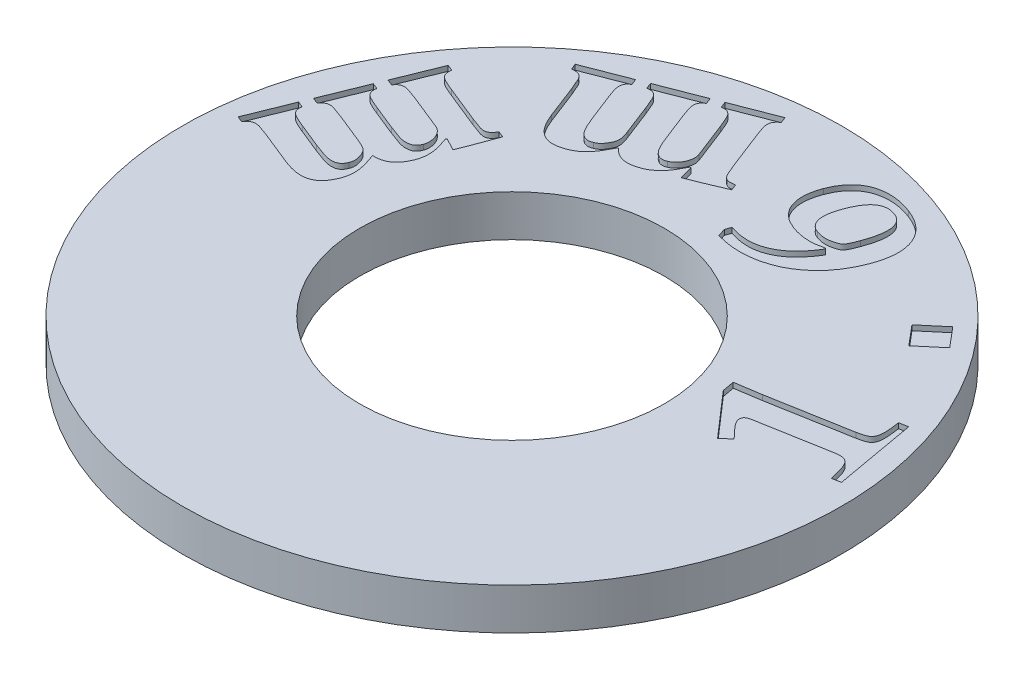
from build123d import *

# Parameters (mm, degrees)
SKETCH1_R           = 12.7
BOSS_EXTRUDE1_DEPTH = 1.6
SKETCH2_R           = 5.8674
CUT_EXTRUDE1_DEPTH  = 19.031638861
CUT_EXTRUDE2_DEPTH  = 0.2


with BuildPart() as part:
    # Sketch1 → Boss-Extrude1 (new body)
    with BuildSketch(Plane(origin=(0, 0, 0), x_dir=(1, 0, 0), z_dir=(0, 1, 0))):
        with Locations(Location((0, 0, 0), (0, 0, 270))):
            Circle(SKETCH1_R)
    extrude(amount=BOSS_EXTRUDE1_DEPTH)

    # Sketch2 → Cut-Extrude1 (cut, through all)
    with BuildSketch(Plane(origin=(0, 0, 0), x_dir=(-1, 0, 0), z_dir=(0, -1, 0))):
        with Locations(Location((0, 0, 0), (0, 0, 90))):
            Circle(SKETCH2_R)
    extrude(amount=-CUT_EXTRUDE1_DEPTH, mode=Mode.SUBTRACT)

    # Sketch4 → Cut-Extrude2 (cut)
    # profile 1 of 5: a face of its own
    with BuildSketch(Plane(origin=(0, 1.6, 0), x_dir=(1, 0, 0), z_dir=(0, 1, 0))):
        with BuildLine():
            add(Edge.make_bspline(
                [(10.502835701, 2.747256944), (10.535958787, 2.753635056), (10.597619367, 2.765508288), (10.68289299, 2.785497337), (10.754934333, 2.804751749), (10.83115688, 2.831434792), (10.908616374, 2.872710013), (10.983063242, 2.939891348), (11.031547566, 3.030268528), (11.057288986, 3.142661226), (11.066935793, 3.278500029), (11.06128653, 3.408848056), (11.053268397, 3.529765111), (11.041774037, 3.63744486), (11.026137193, 3.758286119), (11.014089218, 3.843452977), (11.007748896, 3.888272569)],
                knots=[0, 0, 0, 0, 0.95120931, 1.770732274, 2.469728581, 3.053236218, 4.045778316, 4.92566005, 5.839669914, 6.887844203, 8.156461987, 9.670137205, 10.563586198, 11.574197932, 12.723406461, 14, 14, 14, 14], degree=3))
            Line((11.007748896, 3.888272569), (11.339580493, 3.947803819))
            Line((11.339580493, 3.947803819), (11.900717646, 0.795954861))
            Line((11.900717646, 0.795954861), (11.568886048, 0.736423611))
            add(Edge.make_bspline(
                [(11.568886048, 0.736423611), (11.554803043, 0.798585514), (11.528746521, 0.913598105), (11.489384912, 1.071011026), (11.453602851, 1.199155265), (11.419912183, 1.300799564), (11.386730997, 1.382540059), (11.35336047, 1.450924625), (11.316835265, 1.508004968), (11.277656715, 1.55458428), (11.234590877, 1.59165404), (11.187644786, 1.62258404), (11.134361285, 1.64406377), (11.074344364, 1.659243306), (11.003086635, 1.66500658), (10.917056963, 1.663740947), (10.814442972, 1.651454292), (10.740904843, 1.639267459), (10.701273201, 1.632699653)],
                knots=[0, 0, 0, 0, 2.063073641, 3.817120061, 5.251678484, 6.368851115, 7.281122152, 8.10565521, 8.828216282, 9.469439415, 10.068097664, 10.662010233, 11.280545861, 11.918117793, 12.659047895, 13.586927584, 14.699531502, 16, 16, 16, 16], degree=3))
            Line((10.701273201, 1.632699653), (8.060952021, 1.163064236))
            add(Edge.make_bspline(
                [(8.060952021, 1.163064236), (8.037667348, 1.158078091), (7.994477264, 1.148829432), (7.936130638, 1.128346498), (7.889333412, 1.101785371), (7.854520705, 1.069466258), (7.829800128, 1.032851206), (7.817133941, 0.991590699), (7.810708439, 0.947006345), (7.815062759, 0.916476287), (7.817314868, 0.900685764)],
                knots=[0, 0, 0, 0, 1.400993529, 2.598663486, 3.626413984, 4.544745121, 5.372764933, 6.19368933, 7.065753812, 8, 8, 8, 8], degree=3))
            add(Edge.make_bspline(
                [(7.817314868, 0.900685764), (7.821529308, 0.883943745), (7.830815176, 0.847055295), (7.859831933, 0.790796719), (7.896481283, 0.725393275), (7.938756081, 0.667449744), (7.979789109, 0.614975147), (8.018534287, 0.568769553), (8.063746687, 0.516951587), (8.115980512, 0.459628299), (8.174041538, 0.395714584), (8.239200773, 0.326359636), (8.310840637, 0.251371205), (8.361130158, 0.199858655), (8.387271465, 0.173081597)],
                knots=[0, 0, 0, 0, 0.664509197, 1.464143271, 2.430196891, 3.559892813, 4.226820614, 5.002434619, 5.887259823, 6.881648262, 7.996278507, 9.220784234, 10.555318662, 12, 12, 12, 12], degree=3))
            Line((8.387271465, 0.173081597), (8.04000584, -0.117960069))
            Line((8.04000584, -0.117960069), (6.557236743, 1.585295139))
            Line((6.557236743, 1.585295139), (6.473452021, 2.052725694))
            add(Edge.make_bspline(
                [(6.473452021, 2.052725694), (6.504325495, 2.056351962), (6.569060101, 2.063955416), (6.670587219, 2.076897917), (6.780259537, 2.094127133), (6.898350755, 2.111263083), (7.024355019, 2.131394976), (7.158854817, 2.153428708), (7.301825046, 2.177571224), (7.399872247, 2.194875437), (7.450205493, 2.203758681)],
                knots=[0, 0, 0, 0, 0.754743075, 1.582523401, 2.484708457, 3.449980394, 4.479693127, 5.582710837, 6.759066988, 8, 8, 8, 8], degree=3))
            Line((7.450205493, 2.203758681), (10.502835701, 2.747256944))
        make_face()
    # profile 2 of 5: a face of its own
    with BuildSketch(Plane(origin=(0, 1.6, 0), x_dir=(1, 0, 0), z_dir=(0, 1, 0))):
        Polygon((7.998334498, 7.413598887), (8.851615748, 8.134588471), (9.493230331, 7.375013818), (8.639949081, 6.654024235), align=None)
    # profile 3 of 5: a face of its own
    with BuildSketch(Plane(origin=(0, 1.6, 0), x_dir=(1, 0, 0), z_dir=(0, 1, 0))):
        with BuildLine():
            Line((1.200452366, 6.983777969), (1.280929797, 7.199854358))
            add(Edge.make_bspline(
                [(1.280929797, 7.199854358), (1.343817795, 7.179261353), (1.467155686, 7.138873713), (1.654011169, 7.098413309), (1.836977253, 7.07493453), (2.015597423, 7.068035969), (2.190562747, 7.078072145), (2.361694864, 7.104178741), (2.529159758, 7.148459834), (2.691452106, 7.211129672), (2.849876645, 7.288087424), (3.00262888, 7.382899312), (3.150358517, 7.492976917), (3.291751018, 7.620066885), (3.42880272, 7.760899591), (3.558935253, 7.919039208), (3.685331048, 8.091932582), (3.761884595, 8.216465585), (3.801086047, 8.280236302)],
                knots=[0, 0, 0, 0, 1.055048788, 2.0691944, 3.044229261, 3.994526873, 4.916374231, 5.835814113, 6.751508959, 7.673635849, 8.606948974, 9.557047682, 10.537179467, 11.541963796, 12.586653235, 13.668953384, 14.806320344, 16, 16, 16, 16], degree=3))
            Line((3.801086047, 8.280236302), (3.770217991, 8.307797066))
            add(Edge.make_bspline(
                [(3.770217991, 8.307797066), (3.71414798, 8.294562398), (3.604496336, 8.268680414), (3.440218512, 8.243045281), (3.280238818, 8.230703616), (3.12312468, 8.231653016), (2.966792107, 8.24638583), (2.809094217, 8.274242223), (2.648638057, 8.314787763), (2.542955388, 8.351804744), (2.489193686, 8.370635608)],
                knots=[0, 0, 0, 0, 1.05963004, 2.072233846, 3.055361679, 4.0086536, 4.959232627, 5.940685308, 6.95240852, 8, 8, 8, 8], degree=3))
            add(Edge.make_bspline(
                [(2.489193686, 8.370635608), (2.425678851, 8.396737335), (2.302249784, 8.447461105), (2.132920474, 8.545831273), (1.986886121, 8.662813599), (1.863257967, 8.795473288), (1.764751057, 8.943805026), (1.688468588, 9.103519705), (1.639308535, 9.275732636), (1.612688242, 9.457753868), (1.611225732, 9.648604645), (1.633351871, 9.846131474), (1.675600618, 10.050562667), (1.722178032, 10.185318726), (1.746155491, 10.254689427)],
                knots=[0, 0, 0, 0, 1.077595584, 2.094103196, 3.062986482, 4.006354381, 4.929902502, 5.848931818, 6.774838988, 7.731371815, 8.729829957, 9.762912156, 10.848375697, 12, 12, 12, 12], degree=3))
            add(Edge.make_bspline(
                [(1.746155491, 10.254689427), (1.7763527, 10.329017713), (1.835212514, 10.473896968), (1.951299256, 10.672660048), (2.085665588, 10.848945539), (2.213804547, 10.97741434), (2.326332688, 11.065860187), (2.414590439, 11.126148678), (2.508811454, 11.177493313), (2.606907441, 11.223070875), (2.710126865, 11.260830416), (2.818355474, 11.290046763), (2.930920772, 11.313549546), (3.048111242, 11.328816613), (3.169265694, 11.336319095), (3.294130713, 11.336644782), (3.422555278, 11.327106532), (3.55443731, 11.311041992), (3.689828281, 11.285147679), (3.828062677, 11.250881114), (3.970010998, 11.208775039), (4.064699677, 11.175620405), (4.113073894, 11.158682483)],
                knots=[0, 0, 0, 0, 1.672877526, 3.260740491, 4.787171376, 6.289516588, 7.032212332, 7.772527889, 8.517517252, 9.269110702, 10.028607479, 10.808285605, 11.607046719, 12.427139982, 13.272559756, 14.139283271, 15.03113053, 15.958707747, 16.910946222, 17.906201506, 18.93032764, 20, 20, 20, 20], degree=3))
            add(Edge.make_bspline(
                [(4.113073894, 11.158682483), (4.15697111, 11.141450954), (4.243422618, 11.107515052), (4.368170705, 11.050419534), (4.484996173, 10.987386071), (4.59493391, 10.920003123), (4.697245283, 10.847353308), (4.79277647, 10.769806838), (4.880831456, 10.687287685), (4.961582993, 10.600024174), (5.034609675, 10.508303615), (5.099779246, 10.41208411), (5.157520331, 10.31176066), (5.205939239, 10.20638206), (5.246771826, 10.09693552), (5.280219809, 9.983207721), (5.303980564, 9.864730901), (5.320880501, 9.742517717), (5.328043678, 9.616488704), (5.328305305, 9.48689334), (5.319416583, 9.353933132), (5.301199014, 9.21787529), (5.276088854, 9.078654194), (5.241524935, 8.936320611), (5.198718022, 8.790527437), (5.163826853, 8.693479882), (5.146051325, 8.644038385)],
                knots=[0, 0, 0, 0, 1.098191461, 2.162786548, 3.192832132, 4.188048845, 5.164054587, 6.113082797, 7.051594597, 7.972179555, 8.879742853, 9.779402692, 10.67641257, 11.572442019, 12.476973698, 13.395128669, 14.330043427, 15.288670823, 16.266176383, 17.267519822, 18.30535816, 19.36692158, 20.463110258, 21.598586896, 22.776584751, 24, 24, 24, 24], degree=3))
            add(Edge.make_bspline(
                [(5.146051325, 8.644038385), (5.120410458, 8.577547881), (5.069504659, 8.445541726), (4.979642143, 8.255748764), (4.882591907, 8.073477), (4.7757546, 7.901071263), (4.66050112, 7.736651354), (4.536347737, 7.581334242), (4.401952184, 7.435476143), (4.260695193, 7.298015339), (4.111468893, 7.171081941), (3.956153925, 7.054726669), (3.793202875, 6.951568523), (3.625965791, 6.857262903), (3.452169721, 6.775166977), (3.271848517, 6.706482366), (3.086418619, 6.645984938), (2.895066533, 6.599208672), (2.700286371, 6.564048118), (2.50372428, 6.540540621), (2.305560774, 6.530620344), (2.106360141, 6.534210416), (1.905755587, 6.549850704), (1.704278713, 6.57711169), (1.501495309, 6.618153508), (1.367468793, 6.65450437), (1.299671116, 6.672892552)],
                knots=[0, 0, 0, 0, 1.070823632, 2.125947334, 3.153976389, 4.173332704, 5.172465224, 6.170528418, 7.159609897, 8.15178657, 9.131336938, 10.102378564, 11.066150857, 12.028085339, 12.986779263, 13.952022445, 14.926733186, 15.916739616, 16.91025301, 17.90025944, 18.890219644, 19.890115268, 20.892859756, 21.913053768, 22.944312598, 24, 24, 24, 24], degree=3))
            Line((1.299671116, 6.672892552), (1.200452366, 6.983777969))
        make_face()
        with BuildLine():
            add(Edge.make_bspline(
                [(3.076789172, 8.698057483), (3.132909456, 8.679932439), (3.243010075, 8.644373488), (3.413032857, 8.625283629), (3.576075832, 8.63331494), (3.704133547, 8.658205157), (3.795432605, 8.686357261), (3.852529709, 8.707316756), (3.898519111, 8.728016151), (3.948692476, 8.75488002), (4.001805532, 8.805818747), (4.047266948, 8.872729684), (4.084461884, 8.946478634), (4.119923668, 9.023856133), (4.158569665, 9.121872517), (4.186258552, 9.19376456), (4.201268339, 9.232736302)],
                knots=[0, 0, 0, 0, 1.710541778, 3.355858038, 4.938271646, 6.440062148, 7.13262002, 7.713873542, 8.206199276, 8.598318393, 9.361997601, 10.313061428, 10.938824559, 11.760841173, 12.786181087, 14, 14, 14, 14], degree=3))
            add(Edge.make_bspline(
                [(4.201268339, 9.232736302), (4.219616657, 9.284432015), (4.255072374, 9.384327197), (4.30105685, 9.531510269), (4.335960436, 9.671161482), (4.362974871, 9.803145166), (4.381080853, 9.927152769), (4.388903885, 10.043638718), (4.388039482, 10.152006568), (4.378848483, 10.252989558), (4.358648581, 10.346021304), (4.330820471, 10.43180026), (4.290949714, 10.508625418), (4.24422561, 10.579514316), (4.184064175, 10.639885789), (4.116891173, 10.694879513), (4.038769365, 10.7401109), (3.982187335, 10.763211055), (3.953221464, 10.775036649)],
                knots=[0, 0, 0, 0, 1.500894568, 2.900281813, 4.217152542, 5.437764563, 6.585289063, 7.643385764, 8.628806701, 9.548256839, 10.412033135, 11.229197673, 12.007129352, 12.774066827, 13.542058149, 14.328777375, 15.144455933, 16, 16, 16, 16], degree=3))
            add(Edge.make_bspline(
                [(3.953221464, 10.775036649), (3.919245977, 10.786364872), (3.853943728, 10.80813817), (3.75608292, 10.828911875), (3.662442482, 10.834694319), (3.573482634, 10.826592591), (3.488865702, 10.807977138), (3.408458099, 10.777657234), (3.332269753, 10.736631897), (3.260047544, 10.685155263), (3.191439608, 10.624053207), (3.126309215, 10.552989981), (3.064446481, 10.472120724), (2.985796284, 10.348662157), (2.892809985, 10.174619164), (2.834135004, 10.024617309), (2.803386394, 9.946008871)],
                knots=[0, 0, 0, 0, 0.932873925, 1.793021151, 2.598839487, 3.367856657, 4.113627244, 4.849993345, 5.599749579, 6.36230028, 7.155964143, 7.989527263, 8.87058289, 9.805567893, 11.801908814, 14, 14, 14, 14], degree=3))
            add(Edge.make_bspline(
                [(2.803386394, 9.946008871), (2.789021343, 9.905717802), (2.761142699, 9.82752383), (2.727163126, 9.711565588), (2.69985937, 9.601384176), (2.682829992, 9.496212874), (2.670852833, 9.39695612), (2.668292805, 9.303160591), (2.675472645, 9.215066626), (2.688060026, 9.132630092), (2.708521729, 9.055609287), (2.739278462, 8.985918652), (2.775041981, 8.920834938), (2.820963864, 8.863655968), (2.873499986, 8.812178352), (2.933526127, 8.766434912), (3.002012742, 8.728007435), (3.051553194, 8.708165164), (3.076789172, 8.698057483)],
                knots=[0, 0, 0, 0, 1.424088551, 2.763767271, 4.022183305, 5.201039714, 6.30911801, 7.349523498, 8.319005133, 9.248428938, 10.124185317, 10.962911168, 11.779474492, 12.589779123, 13.394520957, 14.224182145, 15.095395788, 16, 16, 16, 16], degree=3))
        make_face(mode=Mode.SUBTRACT)
    # profile 4 of 5: a face of its own
    with BuildSketch(Plane(origin=(0, 1.6, 0), x_dir=(1, 0, 0), z_dir=(0, 1, 0))):
        with BuildLine():
            Line((-1.500499582, 8.398806621), (-1.545699235, 8.394396899))
            add(Edge.make_bspline(
                [(-1.545699235, 8.394396899), (-1.578680129, 8.328177935), (-1.64156419, 8.201919461), (-1.744030648, 8.02884167), (-1.846044886, 7.880084841), (-1.949946333, 7.754727011), (-2.05857315, 7.650318657), (-2.17357881, 7.562688436), (-2.294646542, 7.48709386), (-2.38188138, 7.450331118), (-2.425438818, 7.431975024)],
                knots=[0, 0, 0, 0, 1.327248858, 2.530640849, 3.606312378, 4.561298934, 5.447501221, 6.30354898, 7.15294094, 8, 8, 8, 8], degree=3))
            add(Edge.make_bspline(
                [(-2.425438818, 7.431975024), (-2.466711164, 7.416501822), (-2.546064862, 7.386751738), (-2.664025189, 7.356362389), (-2.774202536, 7.336715383), (-2.877415506, 7.329477021), (-2.975012839, 7.335492968), (-3.068194376, 7.350780271), (-3.158059284, 7.376341345), (-3.244768044, 7.411813357), (-3.328951411, 7.458526601), (-3.408552551, 7.519497131), (-3.489562903, 7.588502591), (-3.538054885, 7.643001758), (-3.563147151, 7.671202454)],
                knots=[0, 0, 0, 0, 1.261849166, 2.426137807, 3.483538902, 4.464561663, 5.381899843, 6.278343648, 7.164718223, 8.052217243, 8.957088943, 9.91293841, 10.920046081, 12, 12, 12, 12], degree=3))
            add(Edge.make_bspline(
                [(-3.563147151, 7.671202454), (-3.599531182, 7.59843004), (-3.668389116, 7.460705936), (-3.777147706, 7.27123298), (-3.885029972, 7.111206789), (-3.99057811, 6.976050247), (-4.102053829, 6.86480688), (-4.219976724, 6.770641123), (-4.348199055, 6.69203994), (-4.439779694, 6.652578048), (-4.485881526, 6.632712871)],
                knots=[0, 0, 0, 0, 1.370148351, 2.593049264, 3.676206861, 4.618613109, 5.476374145, 6.322127868, 7.155356622, 8, 8, 8, 8], degree=3))
            add(Edge.make_bspline(
                [(-4.485881526, 6.632712871), (-4.530445251, 6.616076964), (-4.615952839, 6.584156465), (-4.743101562, 6.551526654), (-4.861772979, 6.530294812), (-4.973189572, 6.524827778), (-5.078684173, 6.531644554), (-5.178538203, 6.555233414), (-5.275449977, 6.587065021), (-5.366578661, 6.635862424), (-5.452894115, 6.696968271), (-5.534744327, 6.770753064), (-5.613569564, 6.855921676), (-5.687290851, 6.95508305), (-5.757960734, 7.067347228), (-5.826043906, 7.19293182), (-5.891036555, 7.332819596), (-5.93122393, 7.431428083), (-5.952114165, 7.482686829)],
                knots=[0, 0, 0, 0, 1.164238848, 2.233907847, 3.210467445, 4.111618036, 4.95998529, 5.789768502, 6.618037198, 7.451375979, 8.310370773, 9.20280479, 10.145472204, 11.148103074, 12.224265042, 13.392220349, 14.64442181, 16, 16, 16, 16], degree=3))
            Line((-5.952114165, 7.482686829), (-6.443798193, 8.752686829))
            add(Edge.make_bspline(
                [(-6.443798193, 8.752686829), (-6.46298886, 8.80204742), (-6.500138469, 8.897600464), (-6.557518406, 9.031550001), (-6.610596713, 9.14701544), (-6.6652213, 9.236719574), (-6.719195792, 9.30301382), (-6.776882541, 9.349899558), (-6.841998121, 9.381410269), (-6.91741995, 9.396764093), (-7.003583166, 9.400735532), (-7.06413052, 9.395102303), (-7.096437082, 9.392096552)],
                knots=[0, 0, 0, 0, 1.559140996, 3.018210822, 4.290952874, 5.296787436, 6.103062558, 6.795868098, 7.468525882, 8.211398264, 9.045646607, 10, 10, 10, 10], degree=3))
            Line((-7.096437082, 9.392096552), (-7.185733957, 9.621402107))
            Line((-7.185733957, 9.621402107), (-5.508937082, 10.271836135))
            Line((-5.508937082, 10.271836135), (-5.419640207, 10.042530579))
            add(Edge.make_bspline(
                [(-5.419640207, 10.042530579), (-5.44126826, 10.026399982), (-5.481650493, 9.996282175), (-5.533846741, 9.947929725), (-5.570951767, 9.898212078), (-5.594627254, 9.847372575), (-5.604920024, 9.794555745), (-5.609329846, 9.738344691), (-5.607052869, 9.676900081), (-5.596124222, 9.607106489), (-5.574701737, 9.523170129), (-5.540686924, 9.418742082), (-5.495430219, 9.289738424), (-5.459929128, 9.196145913), (-5.440586387, 9.145152107)],
                knots=[0, 0, 0, 0, 0.976263073, 1.822803084, 2.564919562, 3.207680077, 3.833713685, 4.500778585, 5.245986733, 6.052842077, 7.052732165, 8.377616694, 10.026347317, 12, 12, 12, 12], degree=3))
            Line((-5.440586387, 9.145152107), (-5.077886735, 8.212495857))
            add(Edge.make_bspline(
                [(-5.077886735, 8.212495857), (-5.058213378, 8.162818328), (-5.020773209, 8.068277516), (-4.964958774, 7.935032266), (-4.911566849, 7.817607376), (-4.862407323, 7.714442109), (-4.814206633, 7.625009471), (-4.764214553, 7.549826783), (-4.714948421, 7.485912263), (-4.663879121, 7.434812521), (-4.612373766, 7.394089192), (-4.560879865, 7.363706829), (-4.510177119, 7.340304693), (-4.45834347, 7.326789669), (-4.404290481, 7.322415505), (-4.347102358, 7.327322637), (-4.286499427, 7.340839251), (-4.245784961, 7.355102318), (-4.224605485, 7.362521899)],
                knots=[0, 0, 0, 0, 1.886072366, 3.589365554, 5.098767554, 6.438935382, 7.62327005, 8.680997452, 9.623029443, 10.466885591, 11.224590498, 11.934248244, 12.573028465, 13.189694188, 13.814492117, 14.478078476, 15.208303495, 16, 16, 16, 16], degree=3))
            add(Edge.make_bspline(
                [(-4.224605485, 7.362521899), (-4.196124879, 7.375107043), (-4.140617846, 7.399634753), (-4.06647594, 7.453951996), (-4.002096369, 7.521299194), (-3.946506985, 7.600529328), (-3.897145713, 7.683379182), (-3.857845601, 7.766968153), (-3.829112457, 7.850147785), (-3.819086508, 7.936966256), (-3.820853325, 8.026934807), (-3.836167036, 8.105507556), (-3.855045624, 8.176985637), (-3.877649694, 8.244743013), (-3.906253353, 8.326857924), (-3.92895999, 8.385647919), (-3.941280832, 8.41754794)],
                knots=[0, 0, 0, 0, 1.05712718, 2.060278967, 3.103930472, 4.214663213, 5.347149753, 6.382223774, 7.355140304, 8.326206341, 9.339519046, 10.406659634, 11.040664636, 11.855394827, 12.836316401, 14, 14, 14, 14], degree=3))
            Line((-3.941280832, 8.41754794), (-4.381150624, 9.551948982))
            add(Edge.make_bspline(
                [(-4.381150624, 9.551948982), (-4.395843684, 9.589066049), (-4.42322045, 9.65822422), (-4.461713942, 9.755215287), (-4.496936471, 9.837422587), (-4.535923805, 9.924848545), (-4.581174005, 10.013011645), (-4.639853073, 10.097027896), (-4.70584835, 10.158300648), (-4.770957186, 10.189348355), (-4.82925529, 10.203846904), (-4.881158179, 10.209027832), (-4.940539071, 10.208514609), (-4.982726237, 10.205229651), (-5.005126318, 10.20348544)],
                knots=[0, 0, 0, 0, 1.43593228, 2.675492938, 3.753329024, 4.652559938, 6.11901344, 7.311444819, 8.322447917, 9.321542641, 9.866545793, 10.478167495, 11.191953967, 12, 12, 12, 12], degree=3))
            Line((-5.005126318, 10.20348544), (-5.094423193, 10.432790996))
            Line((-5.094423193, 10.432790996), (-3.438572499, 11.074405579))
            Line((-3.438572499, 11.074405579), (-3.349275624, 10.845100024))
            add(Edge.make_bspline(
                [(-3.349275624, 10.845100024), (-3.371829284, 10.829185098), (-3.413734166, 10.799615038), (-3.465251913, 10.749034653), (-3.503876703, 10.69980329), (-3.528520914, 10.648919497), (-3.540482433, 10.595811986), (-3.544340482, 10.539416273), (-3.542185737, 10.47838512), (-3.531505961, 10.409501208), (-3.508063178, 10.326746257), (-3.474739068, 10.222065038), (-3.429638126, 10.092106636), (-3.393324208, 9.997946719), (-3.373529096, 9.946619121)],
                knots=[0, 0, 0, 0, 0.992957471, 1.844922954, 2.591631667, 3.237113429, 3.86329802, 4.54058269, 5.269232777, 6.059395145, 7.045266299, 8.364235463, 10.018105088, 12, 12, 12, 12], degree=3))
            Line((-3.373529096, 9.946619121), (-3.010829443, 9.013962871))
            add(Edge.make_bspline(
                [(-3.010829443, 9.013962871), (-2.996657788, 8.977151092), (-2.969516159, 8.906648973), (-2.928004225, 8.806398578), (-2.891454916, 8.714556702), (-2.844654724, 8.610739499), (-2.791764113, 8.500780224), (-2.730333993, 8.390242101), (-2.666711658, 8.305624809), (-2.604799685, 8.236574129), (-2.538315851, 8.186697449), (-2.473039115, 8.148601797), (-2.403922676, 8.128561555), (-2.329787806, 8.121444181), (-2.246708712, 8.132336889), (-2.1910254, 8.152150967), (-2.160855485, 8.162886482)],
                knots=[0, 0, 0, 0, 1.218376668, 2.33344156, 3.351562828, 4.271279059, 5.850097088, 7.121466675, 8.168044415, 9.115705124, 9.973893436, 10.725810247, 11.436861629, 12.177817345, 13.012718608, 14, 14, 14, 14], degree=3))
            add(Edge.make_bspline(
                [(-2.160855485, 8.162886482), (-2.139651487, 8.17267279), (-2.096037015, 8.192802233), (-2.034047516, 8.233544001), (-1.97680789, 8.28717359), (-1.920611109, 8.347803533), (-1.870920225, 8.417558281), (-1.828079155, 8.49341736), (-1.795216046, 8.575437602), (-1.771331247, 8.661942034), (-1.756280888, 8.749896331), (-1.755281747, 8.83758026), (-1.766801807, 8.92340652), (-1.78547311, 8.977820506), (-1.79484854, 9.005143427)],
                knots=[0, 0, 0, 0, 0.836243377, 1.720067758, 2.64304706, 3.640427864, 4.67827718, 5.704026804, 6.755486752, 7.835339964, 8.915594534, 9.942780013, 10.967007125, 12, 12, 12, 12], degree=3))
            Line((-1.79484854, 9.005143427), (-2.317400624, 10.352313565))
            add(Edge.make_bspline(
                [(-2.317400624, 10.352313565), (-2.337449883, 10.40272207), (-2.374297839, 10.495366407), (-2.426816724, 10.620893065), (-2.471793057, 10.720796935), (-2.510807835, 10.798084427), (-2.54947846, 10.857414013), (-2.587241421, 10.906814316), (-2.629873376, 10.945553523), (-2.675175925, 10.977219168), (-2.728120542, 10.998709343), (-2.789785301, 11.010093904), (-2.861054931, 11.0134522), (-2.911278956, 11.00790917), (-2.938069026, 11.004952454)],
                knots=[0, 0, 0, 0, 1.95560344, 3.594147164, 4.904245662, 5.905587673, 6.710271926, 7.455046029, 8.139409163, 8.778697916, 9.437986146, 10.180991047, 11.02971977, 12, 12, 12, 12], degree=3))
            Line((-2.938069026, 11.004952454), (-3.027365901, 11.23425801))
            Line((-3.027365901, 11.23425801), (-1.360490901, 11.880282315))
            Line((-1.360490901, 11.880282315), (-1.271194026, 11.65097676))
            add(Edge.make_bspline(
                [(-1.271194026, 11.65097676), (-1.294464177, 11.633544837), (-1.337723243, 11.601139), (-1.391337788, 11.547318124), (-1.431986317, 11.49598486), (-1.45922466, 11.443955182), (-1.473163029, 11.3904295), (-1.479948266, 11.334042404), (-1.478351478, 11.2732882), (-1.469043519, 11.204391579), (-1.446753676, 11.121913989), (-1.414774149, 11.018105936), (-1.368617134, 10.890236847), (-1.333428141, 10.796908086), (-1.314188818, 10.745881274)],
                knots=[0, 0, 0, 0, 1.037135948, 1.928029266, 2.705015774, 3.368269828, 4.008263075, 4.669175765, 5.391120458, 6.172527977, 7.146544743, 8.437585155, 10.052275959, 12, 12, 12, 12], degree=3))
            Line((-1.314188818, 10.745881274), (-0.759666249, 9.316028843))
            add(Edge.make_bspline(
                [(-0.759666249, 9.316028843), (-0.743921112, 9.275951927), (-0.714551879, 9.201196888), (-0.672985784, 9.097792191), (-0.636647661, 9.011772902), (-0.597587967, 8.923591054), (-0.551084166, 8.837162329), (-0.490114353, 8.754815403), (-0.417614899, 8.699473063), (-0.347881536, 8.672373402), (-0.282522669, 8.66399496), (-0.221567487, 8.665129956), (-0.1486079, 8.670552639), (-0.096688113, 8.678765615), (-0.06844229, 8.683233704)],
                knots=[0, 0, 0, 0, 1.450579982, 2.705751189, 3.754223165, 4.596399602, 5.953928095, 7.055990142, 8.019135306, 8.987042258, 9.536785458, 10.230042737, 11.037093544, 12, 12, 12, 12], degree=3))
            Line((-0.06844229, 8.683233704), (0.023059446, 8.446211135))
            Line((0.023059446, 8.446211135), (-0.919518679, 8.048233704))
            Line((-0.919518679, 8.048233704), (-1.35828604, 7.878459399))
            Line((-1.35828604, 7.878459399), (-1.500499582, 8.398806621))
        make_face()
    # profile 5 of 5: a face of its own
    with BuildSketch(Plane(origin=(0, 1.6, 0), x_dir=(1, 0, 0), z_dir=(0, 1, 0))):
        with BuildLine():
            Line((-7.16368149, 4.664663168), (-7.190139823, 4.626078099))
            add(Edge.make_bspline(
                [(-7.190139823, 4.626078099), (-7.164649314, 4.55729115), (-7.116159018, 4.42643855), (-7.060406274, 4.234988301), (-7.023567353, 4.059884896), (-7.00352064, 3.899037183), (-7.001186545, 3.748971413), (-7.014304824, 3.605121185), (-7.043445696, 3.465714205), (-7.075877359, 3.377062447), (-7.092023504, 3.332927057)],
                knots=[0, 0, 0, 0, 1.323655474, 2.517974168, 3.594956346, 4.550030047, 5.438835311, 6.298074595, 7.15269428, 8, 8, 8, 8], degree=3))
            add(Edge.make_bspline(
                [(-7.092023504, 3.332927057), (-7.109391964, 3.292567879), (-7.142627793, 3.215337616), (-7.200539997, 3.109008476), (-7.260487173, 3.015474937), (-7.326239511, 2.936063699), (-7.396981172, 2.869399843), (-7.470867554, 2.811013651), (-7.551013684, 2.763937143), (-7.6355474, 2.724328503), (-7.72676892, 2.695727303), (-7.825186481, 2.677359214), (-7.930758256, 2.667037872), (-8.00371313, 2.668508086), (-8.041216212, 2.669263863)],
                knots=[0, 0, 0, 0, 1.263710982, 2.418204165, 3.479912074, 4.456078823, 5.37604635, 6.272872525, 7.159668175, 8.044444074, 8.954083143, 9.901829511, 10.921417382, 12, 12, 12, 12], degree=3))
            add(Edge.make_bspline(
                [(-8.041216212, 2.669263863), (-8.012664087, 2.593533847), (-7.958672874, 2.450330655), (-7.897254148, 2.242338044), (-7.85254913, 2.055967161), (-7.828474389, 1.886937938), (-7.821582298, 1.730088367), (-7.835967702, 1.580047311), (-7.864362196, 1.433331711), (-7.898467654, 1.340098421), (-7.915539129, 1.293430529)],
                knots=[0, 0, 0, 0, 1.370034684, 2.590694547, 3.669965494, 4.612469718, 5.477980982, 6.321354364, 7.159754493, 8, 8, 8, 8], degree=3))
            add(Edge.make_bspline(
                [(-7.915539129, 1.293430529), (-7.933828094, 1.249679925), (-7.968937563, 1.165691549), (-8.032412777, 1.051173337), (-8.098127296, 0.950783898), (-8.169168421, 0.865612476), (-8.246420078, 0.79494002), (-8.330272364, 0.736809993), (-8.42075491, 0.690538837), (-8.517820011, 0.655949713), (-8.620881166, 0.634020694), (-8.730389366, 0.624589087), (-8.845983391, 0.625634916), (-8.968463093, 0.63949925), (-9.097654141, 0.665411655), (-9.234589546, 0.70270052), (-9.380766282, 0.748418167), (-9.479380765, 0.78714462), (-9.530599893, 0.807258654)],
                knots=[0, 0, 0, 0, 1.166157003, 2.238680671, 3.216885827, 4.115430327, 4.960405869, 5.785746922, 6.618928583, 7.454169059, 8.314444076, 9.204437564, 10.154049163, 11.15473713, 12.233078511, 13.393505669, 14.646219497, 16, 16, 16, 16], degree=3))
            Line((-9.530599893, 0.807258654), (-10.788473157, 1.315479141))
            add(Edge.make_bspline(
                [(-10.788473157, 1.315479141), (-10.837198309, 1.335365105), (-10.93189292, 1.374012366), (-11.068701722, 1.422278667), (-11.188218479, 1.464834061), (-11.290776005, 1.48467395), (-11.375475685, 1.492645704), (-11.448840067, 1.482828944), (-11.515458516, 1.455386455), (-11.577987731, 1.411308349), (-11.639513644, 1.351046656), (-11.676868623, 1.303475561), (-11.696875935, 1.277996502)],
                knots=[0, 0, 0, 0, 1.555345476, 3.022727044, 4.290413483, 5.298148995, 6.103883474, 6.795234541, 7.462966408, 8.213258407, 9.043021928, 10, 10, 10, 10], degree=3))
            Line((-11.696875935, 1.277996502), (-11.923976629, 1.369498238))
            Line((-11.923976629, 1.369498238), (-11.253698851, 3.029758654))
            Line((-11.253698851, 3.029758654), (-11.026598157, 2.938256918))
            add(Edge.make_bspline(
                [(-11.026598157, 2.938256918), (-11.029960338, 2.911836404), (-11.036252098, 2.862394837), (-11.033434767, 2.79240084), (-11.025049275, 2.7315848), (-11.004329165, 2.679830814), (-10.973648735, 2.635352947), (-10.936050485, 2.593698422), (-10.890161384, 2.553225869), (-10.831603216, 2.514464236), (-10.756009519, 2.472626088), (-10.656939665, 2.425799437), (-10.532508603, 2.370583843), (-10.439876693, 2.333428213), (-10.389393296, 2.313178793)],
                knots=[0, 0, 0, 0, 0.967159303, 1.809876639, 2.541800689, 3.189784498, 3.816452723, 4.498177879, 5.227655652, 6.036054599, 7.047658258, 8.369166658, 10.021234751, 12, 12, 12, 12], degree=3))
            Line((-10.389393296, 2.313178793), (-9.46555649, 1.939454835))
            add(Edge.make_bspline(
                [(-9.46555649, 1.939454835), (-9.416435453, 1.919663343), (-9.322668242, 1.881883337), (-9.18734965, 1.833023085), (-9.066048718, 1.790442387), (-8.957366929, 1.756626907), (-8.85942748, 1.732245359), (-8.77092797, 1.714460956), (-8.690667974, 1.707752382), (-8.618512686, 1.709648832), (-8.554126568, 1.719571665), (-8.496624311, 1.735804164), (-8.445991571, 1.758412537), (-8.400552882, 1.785931634), (-8.361171178, 1.822733924), (-8.32599669, 1.866972737), (-8.294662925, 1.920259699), (-8.277445532, 1.959460554), (-8.268316907, 1.980244766)],
                knots=[0, 0, 0, 0, 1.878070796, 3.585051825, 5.101820897, 6.437565254, 7.619771183, 8.680584427, 9.635205144, 10.469727393, 11.234690702, 11.940042337, 12.581845515, 13.196613156, 13.814687504, 14.482305303, 15.195321426, 16, 16, 16, 16], degree=3))
            add(Edge.make_bspline(
                [(-8.268316907, 1.980244766), (-8.257534085, 2.009689073), (-8.236657991, 2.066694758), (-8.226074912, 2.157529948), (-8.230994665, 2.250117387), (-8.250700093, 2.344292682), (-8.276670914, 2.436888028), (-8.311695876, 2.521512873), (-8.351553665, 2.599463038), (-8.407820039, 2.665553826), (-8.472844685, 2.726716651), (-8.540547921, 2.768619092), (-8.605705077, 2.80327289), (-8.670466534, 2.83379101), (-8.750396566, 2.86745152), (-8.808146459, 2.891940869), (-8.839375935, 2.905184002)],
                knots=[0, 0, 0, 0, 1.068599134, 2.068862603, 3.100116208, 4.22595035, 5.350943271, 6.381967343, 7.354395825, 8.327473133, 9.332143763, 10.394820174, 11.035447866, 11.855790058, 12.840473138, 14, 14, 14, 14], degree=3))
            Line((-8.839375935, 2.905184002), (-9.962752671, 3.35828296))
            add(Edge.make_bspline(
                [(-9.962752671, 3.35828296), (-9.999481899, 3.373023886), (-10.068383109, 3.400676729), (-10.165061628, 3.438750096), (-10.249327483, 3.467946945), (-10.339095588, 3.499841036), (-10.433888248, 3.52601606), (-10.534459602, 3.542625232), (-10.623541986, 3.535481123), (-10.690147393, 3.509446782), (-10.740536434, 3.476742951), (-10.779725654, 3.442190114), (-10.820605622, 3.398662829), (-10.847127756, 3.365825594), (-10.861233573, 3.348361085)],
                knots=[0, 0, 0, 0, 1.429321889, 2.681298033, 3.75164529, 4.649764094, 6.120981964, 7.299630989, 8.312490044, 9.308162915, 9.845594238, 10.476067727, 11.189495434, 12, 12, 12, 12], degree=3))
            Line((-10.861233573, 3.348361085), (-11.088334268, 3.439862821))
            Line((-11.088334268, 3.439862821), (-10.425773504, 5.080279488))
            Line((-10.425773504, 5.080279488), (-10.19867281, 4.988777752))
            add(Edge.make_bspline(
                [(-10.19867281, 4.988777752), (-10.201858239, 4.961631799), (-10.207829575, 4.910744589), (-10.207140856, 4.838805265), (-10.19770968, 4.776947141), (-10.179195994, 4.723726277), (-10.147745173, 4.679371037), (-10.110751365, 4.637502673), (-10.064112817, 4.598749239), (-10.007231392, 4.558889759), (-9.931144318, 4.519071238), (-9.831850867, 4.472892251), (-9.706557801, 4.417959586), (-9.613382351, 4.379993951), (-9.562570379, 4.359289904)],
                knots=[0, 0, 0, 0, 0.987883534, 1.851864852, 2.592561418, 3.244335589, 3.867287659, 4.544970173, 5.261422686, 6.054072821, 7.053245803, 8.36119061, 10.015624468, 12, 12, 12, 12], degree=3))
            Line((-9.562570379, 4.359289904), (-8.638733573, 3.985565946))
            add(Edge.make_bspline(
                [(-8.638733573, 3.985565946), (-8.602342555, 3.971263897), (-8.532163922, 3.943682962), (-8.431536164, 3.903593616), (-8.338625919, 3.869855838), (-8.254865153, 3.839254486), (-8.177711224, 3.815283931), (-8.10854483, 3.793931764), (-8.045439649, 3.778679486), (-7.973242446, 3.762009696), (-7.890103584, 3.754192271), (-7.798122086, 3.752138733), (-7.716619437, 3.766146747), (-7.644396396, 3.787554258), (-7.581824489, 3.822452219), (-7.527815945, 3.872981313), (-7.47918714, 3.939925785), (-7.455473942, 3.993794839), (-7.442596421, 4.023048585)],
                knots=[0, 0, 0, 0, 1.387864261, 2.676441114, 3.84430266, 4.896286497, 5.84090873, 6.711685298, 7.464586366, 8.145088478, 9.339168239, 10.421756988, 11.399564962, 12.261702271, 13.085184182, 13.916070177, 14.868315879, 16, 16, 16, 16], degree=3))
            add(Edge.make_bspline(
                [(-7.442596421, 4.023048585), (-7.43496743, 4.044919206), (-7.419227741, 4.090041396), (-7.407715803, 4.162997395), (-7.406061599, 4.241064556), (-7.412378632, 4.323228959), (-7.429301397, 4.406950483), (-7.453588567, 4.490709249), (-7.492720292, 4.569957367), (-7.537952794, 4.646781757), (-7.592295953, 4.717403188), (-7.656191247, 4.776941199), (-7.725579248, 4.828485114), (-7.77794394, 4.851542378), (-7.804193643, 4.863100668)],
                knots=[0, 0, 0, 0, 0.831538093, 1.715580859, 2.640822049, 3.634913423, 4.671387569, 5.707861716, 6.759882589, 7.838449821, 8.911500049, 9.948900108, 10.971811692, 12, 12, 12, 12], degree=3))
            Line((-7.804193643, 4.863100668), (-9.138134615, 5.401086779))
            add(Edge.make_bspline(
                [(-9.138134615, 5.401086779), (-9.188050424, 5.421074202), (-9.279847881, 5.457831985), (-9.406256666, 5.506115799), (-9.510320451, 5.539848629), (-9.593239892, 5.565490949), (-9.662819376, 5.578307527), (-9.724573607, 5.583112043), (-9.781839613, 5.580347901), (-9.836038739, 5.568236721), (-9.88708062, 5.543659273), (-9.938099964, 5.50749718), (-9.986725342, 5.455510501), (-10.01784493, 5.415676709), (-10.034410657, 5.394472196)],
                knots=[0, 0, 0, 0, 1.944520183, 3.576061564, 4.891378439, 5.900798065, 6.711411268, 7.444222383, 8.136385948, 8.777834455, 9.437737867, 10.171512257, 11.026650744, 12, 12, 12, 12], degree=3))
            Line((-10.034410657, 5.394472196), (-10.261511351, 5.485973932))
            Line((-10.261511351, 5.485973932), (-9.595643296, 7.136312474))
            Line((-9.595643296, 7.136312474), (-9.368542601, 7.044810738))
            add(Edge.make_bspline(
                [(-9.368542601, 7.044810738), (-9.371377434, 7.016182856), (-9.376677447, 6.962660086), (-9.374845864, 6.887080155), (-9.364481824, 6.822666159), (-9.345267593, 6.767911152), (-9.316385209, 6.721215277), (-9.278746054, 6.679352103), (-9.234893916, 6.638032809), (-9.178125407, 6.59847711), (-9.103069033, 6.558604484), (-9.005374757, 6.510925974), (-8.881286876, 6.456523365), (-8.789133837, 6.419115263), (-8.739054754, 6.398786432)],
                knots=[0, 0, 0, 0, 1.032008193, 1.929445479, 2.705864875, 3.365196111, 3.998682204, 4.662616387, 5.381423776, 6.157394763, 7.137598396, 8.429664271, 10.059758582, 12, 12, 12, 12], degree=3))
            Line((-8.739054754, 6.398786432), (-7.323533921, 5.826624974))
            add(Edge.make_bspline(
                [(-7.323533921, 5.826624974), (-7.283455897, 5.810885439), (-7.208825527, 5.781576425), (-7.105743516, 5.740070081), (-7.018376685, 5.708459099), (-6.928347946, 5.67629474), (-6.834051545, 5.652761921), (-6.733429259, 5.640089928), (-6.644636858, 5.65531928), (-6.577611837, 5.686760257), (-6.527150853, 5.728274843), (-6.484749045, 5.772335649), (-6.439430038, 5.829706804), (-6.409372189, 5.872750724), (-6.393082532, 5.896078099)],
                knots=[0, 0, 0, 0, 1.459074035, 2.716981125, 3.764881563, 4.607585066, 5.954541503, 7.054843656, 8.014947017, 8.967348348, 9.525474058, 10.221121103, 11.035948067, 12, 12, 12, 12], degree=3))
            Line((-6.393082532, 5.896078099), (-6.159367254, 5.801269071))
            Line((-6.159367254, 5.801269071), (-6.513247462, 4.84656421))
            Line((-6.513247462, 4.84656421), (-6.688533921, 4.412206571))
            Line((-6.688533921, 4.412206571), (-7.16368149, 4.664663168))
        make_face()
    extrude(amount=-CUT_EXTRUDE2_DEPTH, mode=Mode.SUBTRACT)


solid = part.part
